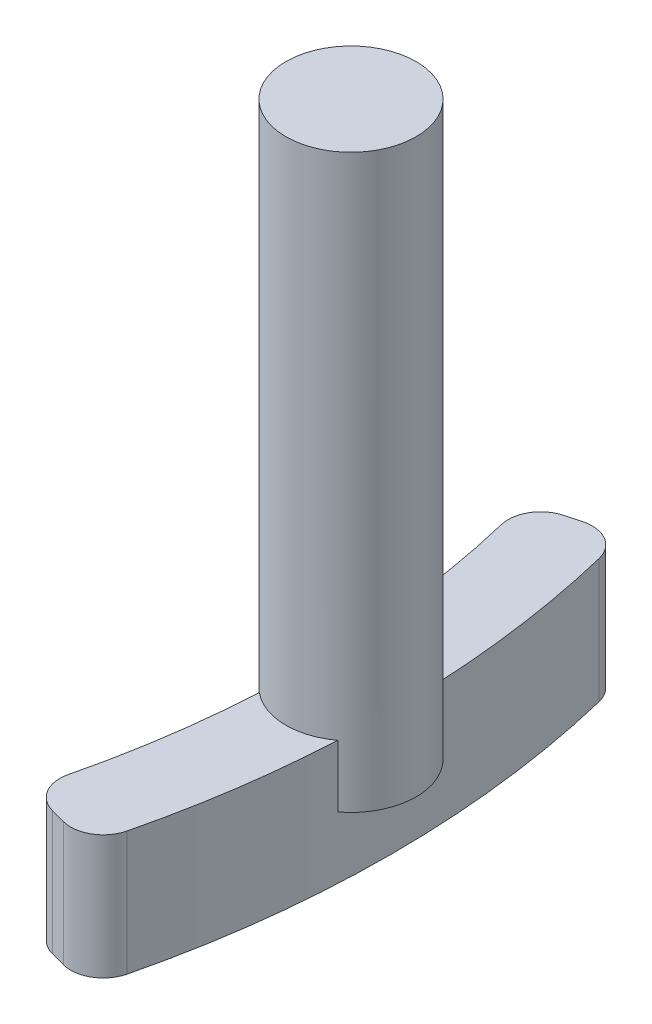
from build123d import *

# Parameters (mm, degrees)
EXTRUDE_1_DEPTH = 4
SKETCH_2_R      = 2.1
EXTRUDE_2_DEPTH = 18.44


with BuildPart() as part:
    # Эскиз1 → Бобышка-Вытянуть1 (new body)
    with BuildSketch(Plane(origin=(0, 0, 0), x_dir=(1, 0, 0), z_dir=(0, 1, 0))):
        with BuildLine():
            Line((-0.953011277, -8.246095785), (-0.469906947, -8.3755432))
            ThreePointArc((-0.469906947, -8.3755432), (0.33772795, -8.26428182), (0.82230527, -7.608661471))
            ThreePointArc((0.82230527, -7.608661471), (1.73125128, 0), (0.82230527, 7.608661471))
            ThreePointArc((0.82230527, 7.608661471), (0.33772795, 8.26428182), (-0.469906947, 8.3755432))
            Line((-0.469906947, 8.3755432), (-0.953011277, 8.246095785))
            ThreePointArc((-0.953011277, 8.246095785), (-1.584107408, 7.767924796), (-1.701799973, 6.98493164))
            ThreePointArc((-1.701799973, 6.98493164), (-0.86874872, 0), (-1.701799973, -6.98493164))
            ThreePointArc((-1.701799973, -6.98493164), (-1.584107408, -7.767924796), (-0.953011277, -8.246095785))
        make_face()
    extrude(amount=EXTRUDE_1_DEPTH)

    # Эскиз2 → Бобышка-Вытянуть2 (add)
    with BuildSketch(Plane(origin=(0, 2, 0), x_dir=(1, 0, 0), z_dir=(0, 1, 0))):
        with Locations(Location((0.43125128, 0, 0), (0, 0, 53.262006522))):
            Circle(SKETCH_2_R)
    extrude(amount=EXTRUDE_2_DEPTH)


solid = part.part
